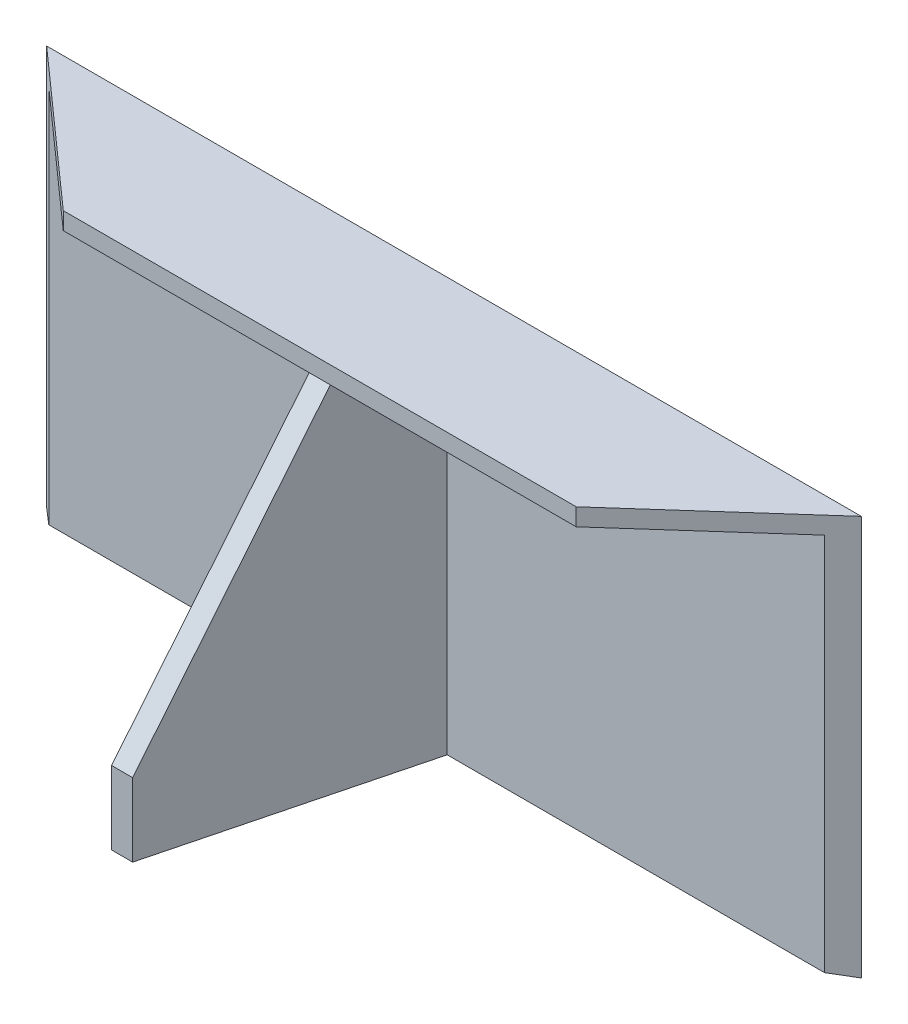
from build123d import *

# Parameters (mm, degrees)
SKETCH_1_W          = 540
SKETCH_1_H          = 265
EXTRUDE_505_DEPTH   = 11.5
SKETCH_2_W          = 540
SKETCH_2_H          = 11.5
EXTRUDE_1_DEPTH     = 77.5
CUT_EXTRUDE_1_DEPTH = 609.067430471
SKETCH_5_W          = 14
SKETCH_5_H          = 253.5
EXTRUDE_2_DEPTH     = 208.5
CUT_EXTRUDE_3_DEPTH = 442.988687638
CUT_EXTRUDE_4_DEPTH = 442.988687638


with BuildPart() as part:
    # 草图1 → Extrude 505 (new body)
    with BuildSketch(Plane.XY):
        with Locations((270, 132.5)):
            Rectangle(SKETCH_1_W, SKETCH_1_H)
    extrude(amount=EXTRUDE_505_DEPTH)

    # 草图2 → 凸台-拉伸1 (add)
    with BuildSketch(Plane.XY.offset(11.5)):
        with Locations((270, 259.25)):
            Rectangle(SKETCH_2_W, SKETCH_2_H)
    extrude(amount=EXTRUDE_1_DEPTH)

    # 草图3 → 切除-拉伸1 (cut, through all)
    with BuildSketch(Plane(origin=(0, 265, 0), x_dir=(-1, 0, 0), z_dir=(0, 1, 0))):
        Polygon((0, 0), (-100, 89), (0, 89), align=None)
        Polygon((-540, 0), (-440, 89), (-540, 89), align=None)
    extrude(amount=-CUT_EXTRUDE_1_DEPTH, mode=Mode.SUBTRACT)

    # 草图5 → 凸台-拉伸2 (add)
    with BuildSketch(Plane.XY.offset(11.5)):
        with Locations((270, 126.75)):
            Rectangle(SKETCH_5_W, SKETCH_5_H)
    extrude(amount=EXTRUDE_2_DEPTH)

    # 草图6 → 切除-拉伸3 (cut, through all)
    with BuildSketch(Plane(origin=(277, 0, 0), x_dir=(0, 0, -1), z_dir=(1, 0, 0))):
        Polygon((-89, 253.5), (-220, 93.5), (-220, 253.5), align=None)
        Polygon((-220, 45), (0, 0), (-220, 0), align=None)
    extrude(amount=-CUT_EXTRUDE_3_DEPTH, mode=Mode.SUBTRACT)

    # 草图7 → 切除-拉伸4 (cut, through all)
    with BuildSketch(Plane.ZY.offset(-277)):
        Polygon((0, 0), (11.5, 2.352272727), (11.5, 0), align=None)
    extrude(amount=-CUT_EXTRUDE_4_DEPTH, mode=Mode.SUBTRACT)


solid = part.part
